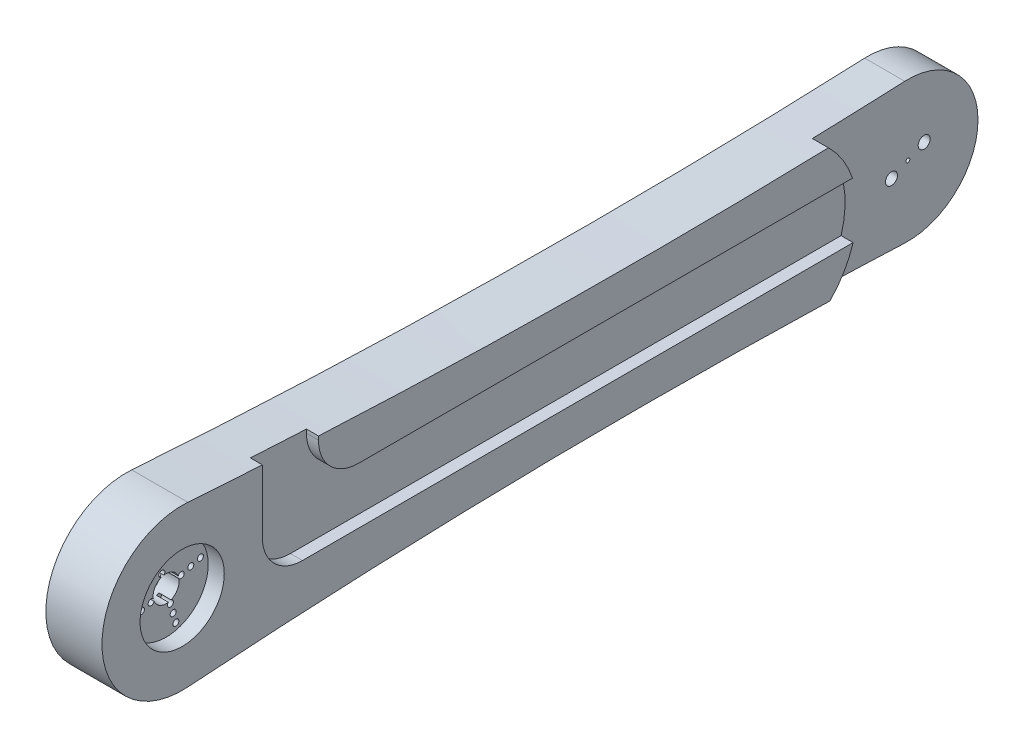
from build123d import *
from build123d.topology import SkipClean

# Parameters (mm, degrees)
SKETCH1_R                = 3.25
SKETCH1_R_2              = 0.5
BOSS_EXTRUDE1_DEPTH      = 18
CUT_EXTRUDE3_START       = -16
SKETCH3_2_R              = 3.25
SKETCH3_2_R_2            = 0.5
CUT_EXTRUDE3_DEPTH       = 1.5
CUT_EXTRUDE15_DEPTH      = 3
SKETCH35_W               = 246.318532416
SKETCH35_H               = 61.223681468
CUT_EXTRUDE23_DEPTH      = 6
CUT_EXTRUDE25_START      = -4
CUT_EXTRUDE25_DEPTH      = 4
SKETCH41_R               = 10.5
CUT_EXTRUDE26_DEPTH      = 4
SKETCH44_R               = 0.75
CUT_EXTRUDE30_DEPTH      = 3
SKETCH45_W               = 160
SKETCH45_H               = 14
CUT_EXTRUDE31_DEPTH      = 3
SKETCH46_W               = 3
SKETCH46_H               = 14
CUT_EXTRUDE32_DEPTH      = 205.653984701
FILLET10_R               = 10
CUT_EXTRUDE33_START      = -4.5
SKETCH47_R               = 1.5
CUT_EXTRUDE33_DEPTH      = 2
CUT_EXTRUDE34_DEPTH      = 204.546677693
CUT_EXTRUDE34_DEPTH_BACK = 204.546677693
SKETCH47_3_R             = 1.5
BOSS_EXTRUDE3_START      = 5
BOSS_EXTRUDE3_DEPTH      = 5
CUT_EXTRUDE36_DEPTH      = 0.5


with BuildPart() as part:
    # Sketch1 → Boss-Extrude1 (new body)
    with BuildSketch(Plane(origin=(0, 0, 0), x_dir=(0, 0, -1), z_dir=(1, 0, 0))):
        with BuildLine():
            ThreePointArc((1.412037037, 19.950091514), (-20, 0), (1.412037037, -19.950091514))
            ThreePointArc((1.412037037, -19.950091514), (92.788701413, -16.103034328), (184.235896445, -17.483310492))
            ThreePointArc((184.235896445, -17.483310492), (202.5, 0), (184.235896445, 17.483310492))
            ThreePointArc((184.235896445, 17.483310492), (92.788701413, 16.103034328), (1.412037037, 19.950091514))
        make_face()
        Circle(SKETCH1_R, mode=Mode.SUBTRACT)
        with Locations((185, 0)):
            Circle(SKETCH1_R_2, mode=Mode.SUBTRACT)
    extrude(amount=BOSS_EXTRUDE1_DEPTH)

    # Sketch3<2> → Cut-Extrude3 (cut)
    with BuildSketch(Plane(origin=(18, 0, 0), x_dir=(0, 0, -1), z_dir=(1, 0, 0)).offset(CUT_EXTRUDE3_START)):
        with BuildLine():
            ThreePointArc((1.200231481, -16.957577787), (92.748227103, -13.103307369), (184.366885626, -14.48617155))
            ThreePointArc((184.366885626, -14.48617155), (199.5, 0), (184.366885626, 14.48617155))
            ThreePointArc((184.366885626, 14.48617155), (92.748227103, 13.103307369), (1.200231481, 16.957577787))
            ThreePointArc((1.200231481, 16.957577787), (-17, 0), (1.200231481, -16.957577787))
        make_face()
        Circle(SKETCH3_2_R, mode=Mode.SUBTRACT)
        with BuildLine():
            ThreePointArc((30.633984963, -12.142135717), (17.841324221, 0), (30.633984963, 12.142135717))
            ThreePointArc((30.633984963, 12.142135717), (80.252181851, 10.319958738), (129.902994017, 10.032482423))
            ThreePointArc((129.902994017, 10.032482423), (140.032951397, 0), (129.902994017, -10.032482423))
            ThreePointArc((129.902994017, -10.032482423), (80.252181851, -10.319958738), (30.633984963, -12.142135717))
        make_face(mode=Mode.SUBTRACT)
        with Locations((185, 0)):
            Circle(SKETCH3_2_R_2, mode=Mode.SUBTRACT)
    extrude(amount=CUT_EXTRUDE3_DEPTH, mode=Mode.SUBTRACT)

    # Sketch23 → Cut-Extrude15 (cut)
    with BuildSketch(Plane.ZY):
        with BuildLine():
            ThreePointArc((-184.235896445, 17.483310492), (-92.788701413, 16.103034328), (-1.412037037, 19.950091514))
            ThreePointArc((-1.412037037, 19.950091514), (20, 0), (-1.412037037, -19.950091514))
            ThreePointArc((-1.412037037, -19.950091514), (-92.788701413, -16.103034328), (-184.235896445, -17.483310492))
            ThreePointArc((-184.235896445, -17.483310492), (-202.5, 0), (-184.235896445, 17.483310492))
        make_face()
    extrude(amount=-CUT_EXTRUDE15_DEPTH, mode=Mode.SUBTRACT)

    # Sketch35 → Cut-Extrude23 (cut)
    with BuildSketch(Plane(origin=(18, 0, 0), x_dir=(0, 0, -1), z_dir=(1, 0, 0))):
        with Locations((100.173806546, -0.711903273)):
            Rectangle(SKETCH35_W, SKETCH35_H)
    extrude(amount=-CUT_EXTRUDE23_DEPTH, mode=Mode.SUBTRACT)

    # Sketch40 → Cut-Extrude25 (cut)
    with BuildSketch(Plane(origin=(12, 0, 0), x_dir=(0, 0, -1), z_dir=(1, 0, 0)).offset(CUT_EXTRUDE25_START)):
        with BuildLine():
            ThreePointArc((161.17448747, 16.641994074), (168.343842012, 0.074036527), (161.5542921, -16.65315313))
            ThreePointArc((161.5542921, -16.65315313), (172.896566315, -17.028012583), (184.235896445, -17.483310492))
            ThreePointArc((184.235896445, -17.483310492), (202.5, 0), (184.235896445, 17.483310492))
            ThreePointArc((184.235896445, 17.483310492), (172.706708762, 17.021074995), (161.17448747, 16.641994074))
        make_face()
    extrude(amount=CUT_EXTRUDE25_DEPTH, mode=Mode.SUBTRACT)

    # Sketch41 → Cut-Extrude26 (cut)
    with BuildSketch(Plane(origin=(12, 0, 0), x_dir=(0, 0, -1), z_dir=(1, 0, 0))):
        Circle(SKETCH41_R)
    extrude(amount=-CUT_EXTRUDE26_DEPTH, mode=Mode.SUBTRACT)

    # Sketch44 → Cut-Extrude30 (cut)
    with BuildSketch(Plane(origin=(8, 0, 0), x_dir=(0, 0, -1), z_dir=(1, 0, 0))):
        with Locations((-2.434853527, 8.556811816)):
            Circle(SKETCH44_R)
        with Locations((-1.750636089, 6.15226477)):
            Circle(SKETCH44_R)
        with Locations((-1.066418651, 3.747717723)):
            Circle(SKETCH44_R)
        with Locations((3.747717723, 1.066418651)):
            Circle(SKETCH44_R)
        with Locations((6.15226477, 1.750636089)):
            Circle(SKETCH44_R)
        with Locations((8.556811816, 2.434853527)):
            Circle(SKETCH44_R)
        with Locations((1.066418651, -3.747717723)):
            Circle(SKETCH44_R)
        with Locations((1.750636089, -6.15226477)):
            Circle(SKETCH44_R)
        with Locations((2.434853527, -8.556811816)):
            Circle(SKETCH44_R)
        with Locations((-3.747717723, -1.066418651)):
            Circle(SKETCH44_R)
        with Locations((-6.15226477, -1.750636089)):
            Circle(SKETCH44_R)
        with Locations((-8.556811816, -2.434853527)):
            Circle(SKETCH44_R)
    extrude(amount=-CUT_EXTRUDE30_DEPTH, mode=Mode.SUBTRACT)

    # Sketch45 → Cut-Extrude31 (cut)
    with BuildSketch(Plane(origin=(12, 0, 0), x_dir=(0, 0, -1), z_dir=(1, 0, 0))):
        with Locations((100, 0.074036527)):
            Rectangle(SKETCH45_W, SKETCH45_H)
    extrude(amount=-CUT_EXTRUDE31_DEPTH, mode=Mode.SUBTRACT)

    # Sketch46 → Cut-Extrude32 (cut, through all)
    with BuildSketch(Plane.XZ.offset(-7.074036527)):
        with Locations((10.5, -27)):
            Rectangle(SKETCH46_W, SKETCH46_H)
    extrude(amount=-CUT_EXTRUDE32_DEPTH, mode=Mode.SUBTRACT)

    # Fillet10
    fillet10_edges = [part.edges().sort_by_distance(p)[0] for p in [
        (10.5, -6.925963473, -20),
        (10.5, 7.074036527, -34),
    ]]
    fillet(fillet10_edges, radius=FILLET10_R)

    # Sketch47 → Cut-Extrude33 (cut)
    # profile 1 of 4: a face of its own
    with BuildSketch(Plane(origin=(8, 0, 0), x_dir=(0, 0, -1), z_dir=(1, 0, 0)).offset(CUT_EXTRUDE33_START)):
        Polygon((181.523149891, -5.313256306), (184.176805684, -3.086574709), (183.575270751, 0.324899419), (180.320080026, 1.50969195), (177.666424233, -0.716989647), (178.267959166, -4.128463775), align=None)
        with Locations((180.921614958, -1.901782178)):
            Circle(SKETCH47_R, mode=Mode.SUBTRACT)
    # profile 2 of 4: a face of its own
    with BuildSketch(Plane(origin=(8, 0, 0), x_dir=(0, 0, -1), z_dir=(1, 0, 0)).offset(CUT_EXTRUDE33_START)):
        with Locations((180.921614958, -1.901782178)):
            Circle(SKETCH47_R)
    # profile 3 of 4: a face of its own
    with BuildSketch(Plane(origin=(8, 0, 0), x_dir=(0, 0, -1), z_dir=(1, 0, 0)).offset(CUT_EXTRUDE33_START)):
        Polygon((188.476850109, 5.313256306), (185.823194316, 3.086574709), (186.424729249, -0.324899419), (189.679919974, -1.50969195), (192.333575767, 0.716989647), (191.732040834, 4.128463775), align=None)
        with Locations((189.078385042, 1.901782178)):
            Circle(SKETCH47_R, mode=Mode.SUBTRACT)
    # profile 4 of 4: a face of its own
    with BuildSketch(Plane(origin=(8, 0, 0), x_dir=(0, 0, -1), z_dir=(1, 0, 0)).offset(CUT_EXTRUDE33_START)):
        with Locations((189.078385042, 1.901782178)):
            Circle(SKETCH47_R)
    extrude(amount=CUT_EXTRUDE33_DEPTH, mode=Mode.SUBTRACT)

    # Sketch47<3> → Cut-Extrude34 (cut, two sides: drawn at the far end of the back side and taken through both)
    with BuildSketch(Plane(origin=(8, 0, 0), x_dir=(0, 0, -1), z_dir=(1, 0, 0)).offset(-CUT_EXTRUDE34_DEPTH_BACK)):
        with Locations((180.921614958, -1.901782178)):
            Circle(SKETCH47_3_R)
        with Locations((189.078385042, 1.901782178)):
            Circle(SKETCH47_3_R)
    extrude(amount=CUT_EXTRUDE34_DEPTH + CUT_EXTRUDE34_DEPTH_BACK, mode=Mode.SUBTRACT)

    # Sketch50 → Boss-Extrude3 (add)
    with SkipClean():  # the faces are left unmerged after this step: merging them gives an invalid solid
        with BuildSketch(Plane.ZY.offset(-3).offset(BOSS_EXTRUDE3_START)):
            with BuildLine():
                ThreePointArc((-184.235896445, 17.483310492), (-202.5, 0), (-184.235896445, -17.483310492))
                ThreePointArc((-184.235896445, -17.483310492), (-92.788701413, -16.103034328), (-1.412037037, -19.950091514))
                ThreePointArc((-1.412037037, -19.950091514), (20, 0), (-1.412037037, 19.950091514))
                ThreePointArc((-1.412037037, 19.950091514), (-92.788701413, 16.103034328), (-184.235896445, 17.483310492))
            make_face()
            with BuildLine():
                ThreePointArc((-184.366885626, 14.48617155), (-92.748227103, 13.103307369), (-1.200231481, 16.957577787))
                ThreePointArc((-1.200231481, 16.957577787), (17, 0), (-1.200231481, -16.957577787))
                ThreePointArc((-1.200231481, -16.957577787), (-92.748227103, -13.103307369), (-184.366885626, -14.48617155))
                ThreePointArc((-184.366885626, -14.48617155), (-199.5, 0), (-184.366885626, 14.48617155))
            make_face(mode=Mode.SUBTRACT)
        extrude(amount=-BOSS_EXTRUDE3_DEPTH)

    # Sketch51 → Cut-Extrude36 (cut)
    with SkipClean():  # the faces are left unmerged after this step: merging them gives an invalid solid
        with BuildSketch(Plane.ZY.offset(-3)):
            with BuildLine():
                ThreePointArc((-30.633984963, -12.142135717), (-80.252181851, -10.319958738), (-129.902994017, -10.032482423))
                ThreePointArc((-129.902994017, -10.032482423), (-140.032951397, 0), (-129.902994017, 10.032482423))
                ThreePointArc((-129.902994017, 10.032482423), (-80.252181851, 10.319958738), (-30.633984963, 12.142135717))
                ThreePointArc((-30.633984963, 12.142135717), (-17.841324221, 0), (-30.633984963, -12.142135717))
            make_face()
        extrude(amount=-CUT_EXTRUDE36_DEPTH, mode=Mode.SUBTRACT)


solid = part.part
